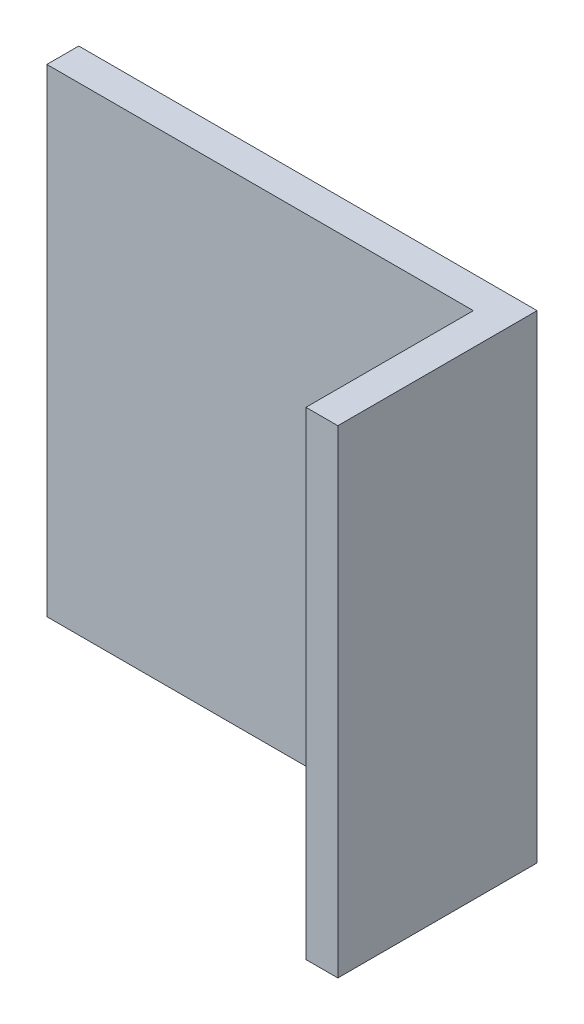
from build123d import *

# Parameters (mm, degrees)
SKETCH_1_W      = 230
SKETCH_1_H      = 240
EXTRUDE_1_DEPTH = 16
SKETCH_4_W      = 16
SKETCH_4_H      = 240
EXTRUDE_2_DEPTH = 84


with BuildPart() as part:
    # 草图1 → 凸台-拉伸1 (new body)
    with BuildSketch(Plane.XY):
        Rectangle(SKETCH_1_W, SKETCH_1_H)
    extrude(amount=EXTRUDE_1_DEPTH)

    # 草图4 → 凸台-拉伸2 (add)
    with BuildSketch(Plane.XY.offset(16)):
        with Locations((107, 0)):
            Rectangle(SKETCH_4_W, SKETCH_4_H)
    extrude(amount=EXTRUDE_2_DEPTH)


solid = part.part
